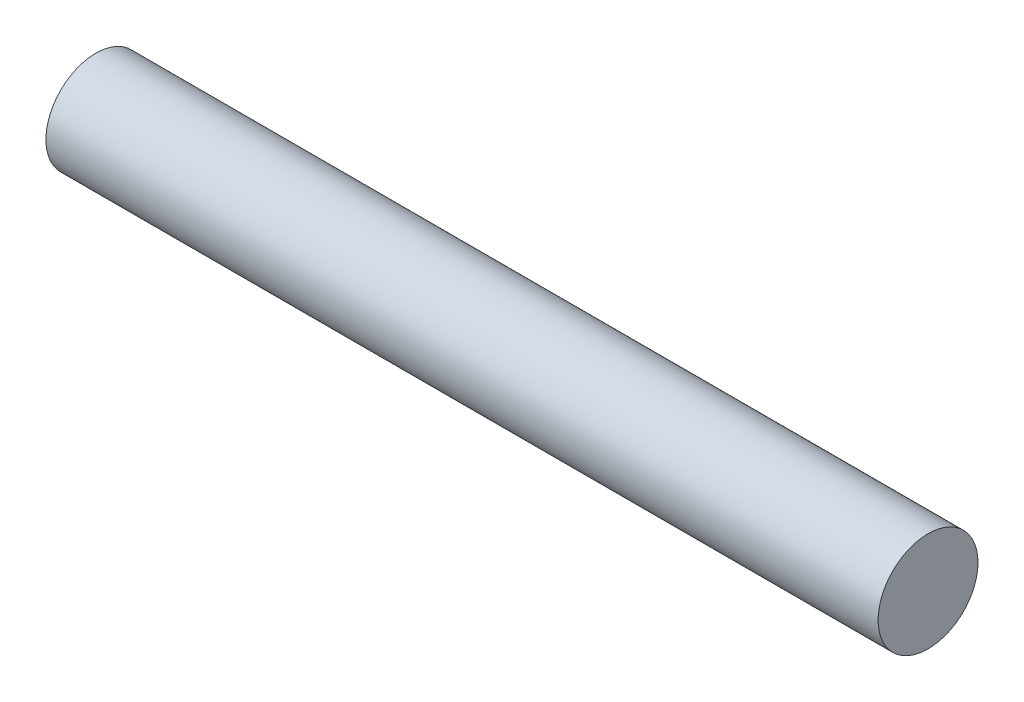
from build123d import *

# Parameters (mm, degrees)
SKETCH1_R           = 3
BOSS_EXTRUDE1_DEPTH = 25


with BuildPart() as part:
    # Sketch1 → Boss-Extrude1 (new, symmetric)
    with BuildSketch(Plane(origin=(0, 0, 0), x_dir=(0, 0, -1), z_dir=(1, 0, 0))):
        Circle(SKETCH1_R)
    extrude(amount=BOSS_EXTRUDE1_DEPTH, both=True)


solid = part.part
